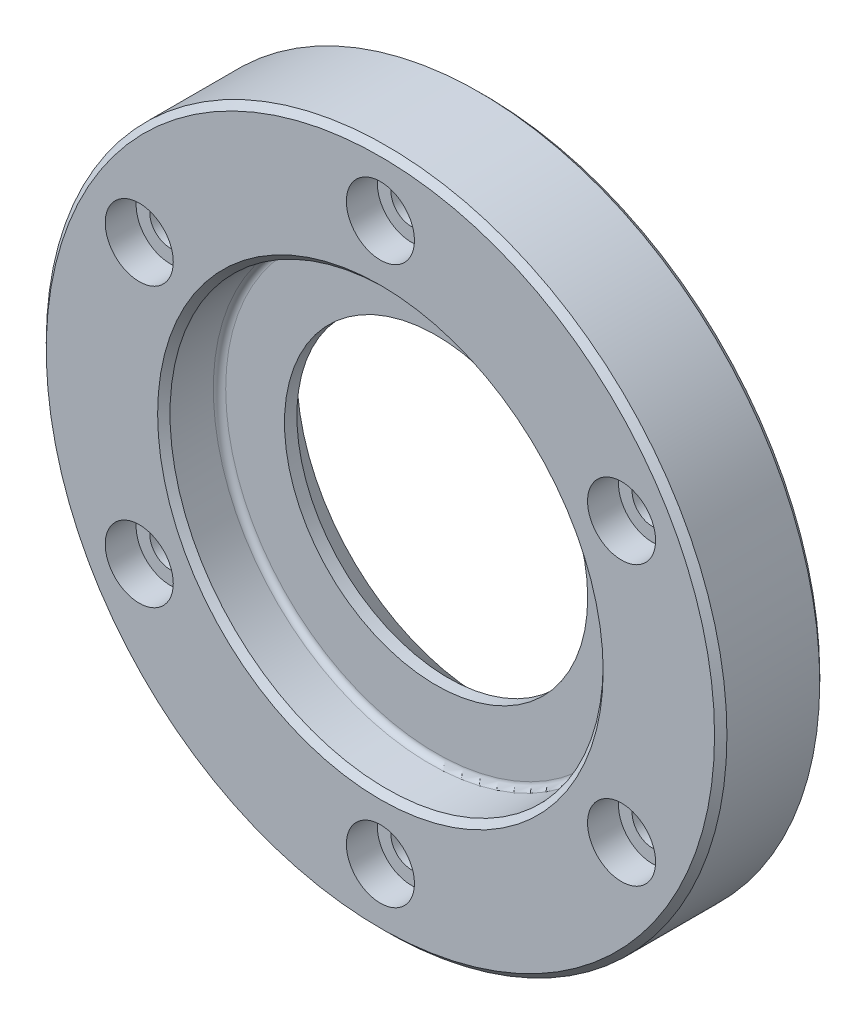
from build123d import *

# Parameters (mm, degrees)
CBORE_FOR_M6_HEX_SOCKET_HEAD_CAP_SCREW1_D           = 6.6
CBORE_FOR_M6_HEX_SOCKET_HEAD_CAP_SCREW1_CBORE_D     = 11
CBORE_FOR_M6_HEX_SOCKET_HEAD_CAP_SCREW1_CBORE_DEPTH = 5
CIRPATTERN1_COUNT                                   = 6


with BuildPart() as part:
    # Sketch1 → Revolve1 (revolve)
    with BuildSketch(Plane(origin=(0, 0, 0), x_dir=(0, 0, -1), z_dir=(1, 0, 0)), mode=Mode.PRIVATE) as revolve1_sk:
        with BuildLine():
            Line((9, 24.5), (11, 24.5))
            Line((11, 24.5), (17, 30.5))
            Line((17, 30.5), (17, 54))
            Line((17, 54), (16, 55))
            Line((16, 55), (1, 55))
            Line((1, 55), (0, 54))
            Line((0, 54), (0, 36))
            Line((0, 36), (1, 35))
            Line((1, 35), (8, 35))
            ThreePointArc((8, 35), (8.707106781, 34.707106781), (9, 34))
            Line((9, 34), (9, 24.5))
        make_face()
    revolve(revolve1_sk.sketch.rotate(Axis((0, 0, 0), (0, 0, -1)), 90), axis=Axis((0, 0, 0), (0, 0, -1)))

    # CBORE for M6 Hex Socket Head Cap Screw1 (through all)
    with Locations(Plane.XY):
        with Locations((0, 45)):
            cbore_for_m6_hex_socket_head_cap_screw1 = CounterBoreHole(CBORE_FOR_M6_HEX_SOCKET_HEAD_CAP_SCREW1_D / 2, CBORE_FOR_M6_HEX_SOCKET_HEAD_CAP_SCREW1_CBORE_D / 2, CBORE_FOR_M6_HEX_SOCKET_HEAD_CAP_SCREW1_CBORE_DEPTH)

    # CirPattern1: CBORE for M6 Hex Socket Head Cap Screw1 ×6 about axis
    cirpattern1_axis = Axis((0, 0, 0), (0, 0, 1))
    for i in range(1, CIRPATTERN1_COUNT):
        add(cbore_for_m6_hex_socket_head_cap_screw1.rotate(cirpattern1_axis, i * 360 / CIRPATTERN1_COUNT), mode=Mode.SUBTRACT)


solid = part.part
